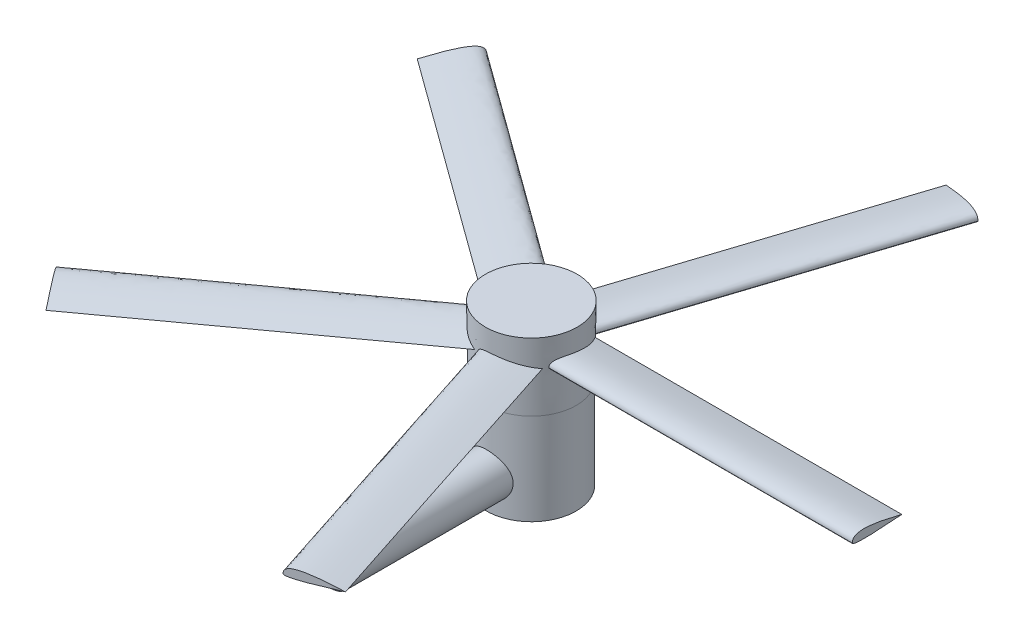
from build123d import *

# Parameters (mm, degrees)
BOSS_EXTRUDE1_DEPTH = 304.8
CIRPATTERN1_COUNT   = 5
SKETCH4_R           = 18.940035463
BOSS_EXTRUDE2_DEPTH = 177.8


with BuildPart() as part:
    # Sketch1 → Revolve1 (revolve)
    with BuildSketch(Plane.XY, mode=Mode.PRIVATE) as revolve1_sk:
        Polygon((39.860812092, 304.8), (0, 264.939187908), (0, 223.582670835), (39.860812092, 223.582670835), align=None)
    revolve(revolve1_sk.sketch.rotate(Axis((0, 223.582670835, 0), (0, 1, 0)), 90), axis=Axis((0, 223.582670835, 0), (0, 1, 0)))

    # Sketch2 → Revolve2 (revolve)
    with BuildSketch(Plane(origin=(0, 0, 0), x_dir=(0, 0, -1), z_dir=(1, 0, 0)), mode=Mode.PRIVATE) as revolve2_sk:
        Polygon((39.860812092, 304.8), (40.752588079, 365.521147905), (0, 365.521147905), (0, 264.939187908), align=None)
    revolve(revolve2_sk.sketch.rotate(Axis((0, 365.521147905, 0), (0, -1, 0)), 180), axis=Axis((0, 365.521147905, 0), (0, -1, 0)))

    # Sketch3 → Boss-Extrude1 (add)
    with BuildSketch(Plane(origin=(0, 0, 0), x_dir=(0, 0, -1), z_dir=(1, 0, 0))):
        with BuildLine():
            add(Edge.make_bspline(
                [(-19.752889725, 341.315485371), (-19.752889725, 350.862201435), (0.408567961, 347.398038579), (24.292898678, 341.315485371)],
                knots=[0, 0, 0, 0, 1, 1, 1, 1], degree=3))
            add(Edge.make_bspline(
                [(-19.752889725, 341.315485371), (-19.752889725, 337.761786872), (24.292898678, 341.315485371)],
                knots=[0, 0, 0, 1, 1, 1], degree=2))
        make_face()
    boss_extrude1 = extrude(amount=BOSS_EXTRUDE1_DEPTH)

    # CirPattern1: Boss-Extrude1 ×5 about axis
    cirpattern1_axis = Axis((0, 365.521147905, 0), (0, 1, 0))
    for i in range(1, CIRPATTERN1_COUNT):
        add(boss_extrude1.rotate(cirpattern1_axis, i * 360 / CIRPATTERN1_COUNT))

    # Sketch4 → Boss-Extrude2 (add)
    with BuildSketch(Plane.XY):
        with Locations(Location((0, 251.915087497, 0), (0, 0, 180))):
            Circle(SKETCH4_R)
    extrude(amount=BOSS_EXTRUDE2_DEPTH)


solid = part.part
